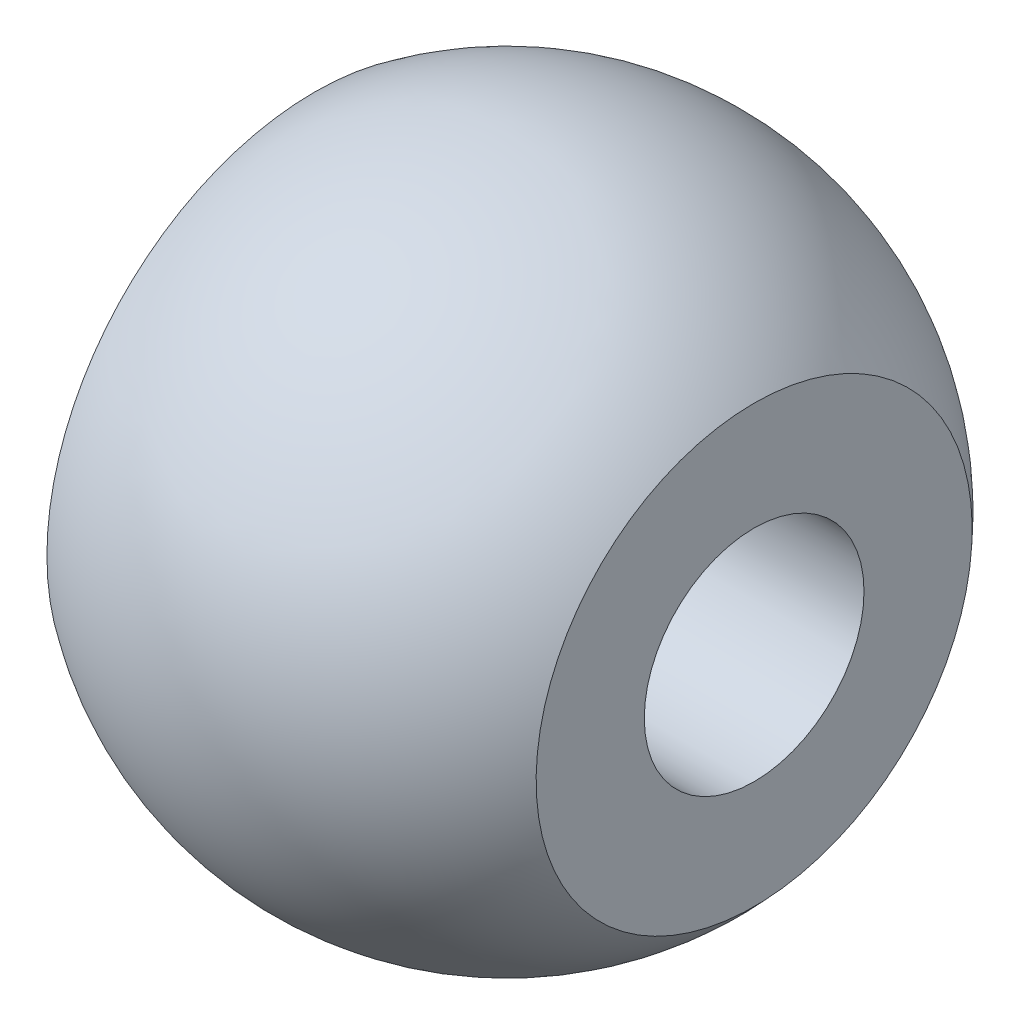
from build123d import *


with BuildPart() as part:
    # Sketch1 → Revolve1 (revolve)
    with BuildSketch(Plane.XY, mode=Mode.PRIVATE) as revolve1_sk:
        with BuildLine():
            Line((-1.841043369, 2), (4.5, 2))
            Line((4.5, 2), (4.5, 3.968626967))
            ThreePointArc((4.5, 3.968626967), (0.674279083, 5.961991925), (-3.5, 4.873397172))
            Line((-3.5, 4.873397172), (-1.841043369, 2))
        make_face()
    revolve(revolve1_sk.sketch.rotate(Axis((0, 0, 0), (1, 0, 0)), 90), axis=Axis((0, 0, 0), (1, 0, 0)))


solid = part.part
